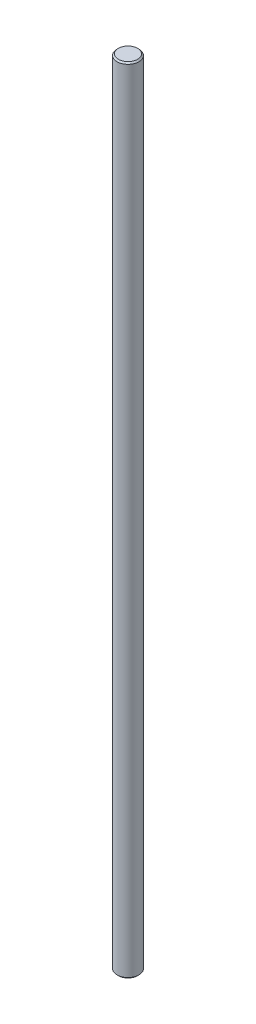
from build123d import *

# Parameters (mm, degrees)
SKETCH1_R           = 4
BOSS_EXTRUDE1_DEPTH = 145
CHAMFER1_SIZE       = 0.5


with BuildPart() as part:
    # Sketch1 → Boss-Extrude1 (new, symmetric)
    with BuildSketch(Plane(origin=(0, 0, 0), x_dir=(1, 0, 0), z_dir=(0, 1, 0))):
        with Locations(Location((0, 0, 0), (0, 0, 270))):
            Circle(SKETCH1_R)
    extrude(amount=BOSS_EXTRUDE1_DEPTH, both=True)

    # Chamfer1
    chamfer1_edges = [part.edges().sort_by_distance(p)[0] for p in [
        (0, -145, -4),
        (0, 145, -4),
    ]]
    chamfer(chamfer1_edges, length=CHAMFER1_SIZE)


solid = part.part
